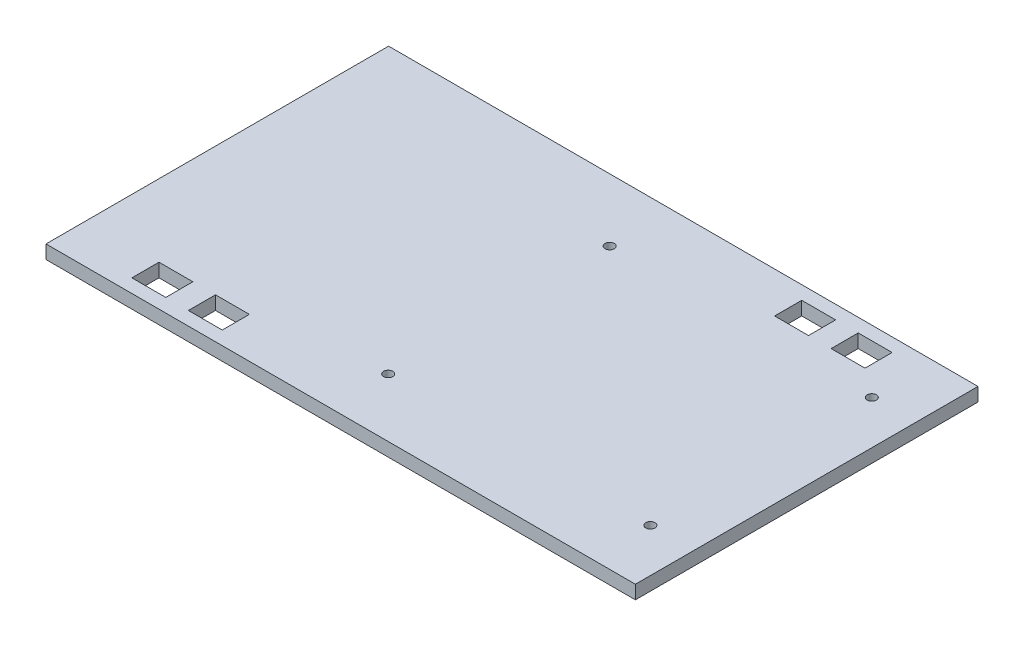
from build123d import *

# Parameters (mm, degrees)
SKETCH1_W           = 130.41
SKETCH1_H           = 75.8
BOSS_EXTRUDE1_DEPTH = 3
SKETCH5_W           = 7.5
SKETCH5_H           = 6
CUT_EXTRUDE4_DEPTH  = 151.868844033
SKETCH6_W           = 7.5
SKETCH6_H           = 6
CUT_EXTRUDE5_DEPTH  = 151.868844033
SKETCH8_R           = 1.025
CUT_EXTRUDE7_DEPTH  = 151.868844033
SKETCH9_R           = 1.025
CUT_EXTRUDE8_DEPTH  = 151.868844033


with BuildPart() as part:
    # Sketch1 → Boss-Extrude1 (new body)
    with BuildSketch(Plane(origin=(0, 0, 0), x_dir=(1, 0, 0), z_dir=(0, 1, 0))):
        with Locations((65.205, -37.9)):
            Rectangle(SKETCH1_W, SKETCH1_H)
    extrude(amount=BOSS_EXTRUDE1_DEPTH)

    # Sketch5 → Cut-Extrude4 (cut, through all)
    with BuildSketch(Plane.XZ):
        with Locations((32.25, 69.8)):
            Rectangle(SKETCH5_W, SKETCH5_H)
        with Locations((19.75, 69.8)):
            Rectangle(SKETCH5_W, SKETCH5_H)
    extrude(amount=-CUT_EXTRUDE4_DEPTH, mode=Mode.SUBTRACT)

    # Sketch6 → Cut-Extrude5 (cut, through all)
    with BuildSketch(Plane.XZ):
        with Locations((98.16, 6)):
            Rectangle(SKETCH6_W, SKETCH6_H)
        with Locations((110.66, 6)):
            Rectangle(SKETCH6_W, SKETCH6_H)
    extrude(amount=-CUT_EXTRUDE5_DEPTH, mode=Mode.SUBTRACT)

    # Sketch8 → Cut-Extrude7 (cut, through all)
    with BuildSketch(Plane.XZ):
        with Locations(Location((120.77, 13.86, 0), (0, 0, 270))):
            Circle(SKETCH8_R)
        with Locations(Location((120.77, 62.86, 0), (0, 0, 270))):
            Circle(SKETCH8_R)
    extrude(amount=-CUT_EXTRUDE7_DEPTH, mode=Mode.SUBTRACT)

    # Sketch9 → Cut-Extrude8 (cut, through all)
    with BuildSketch(Plane.XZ):
        with Locations(Location((62.77, 13.86, 0), (0, 0, 270))):
            Circle(SKETCH9_R)
        with Locations(Location((62.77, 62.86, 0), (0, 0, 270))):
            Circle(SKETCH9_R)
    extrude(amount=-CUT_EXTRUDE8_DEPTH, mode=Mode.SUBTRACT)


solid = part.part
